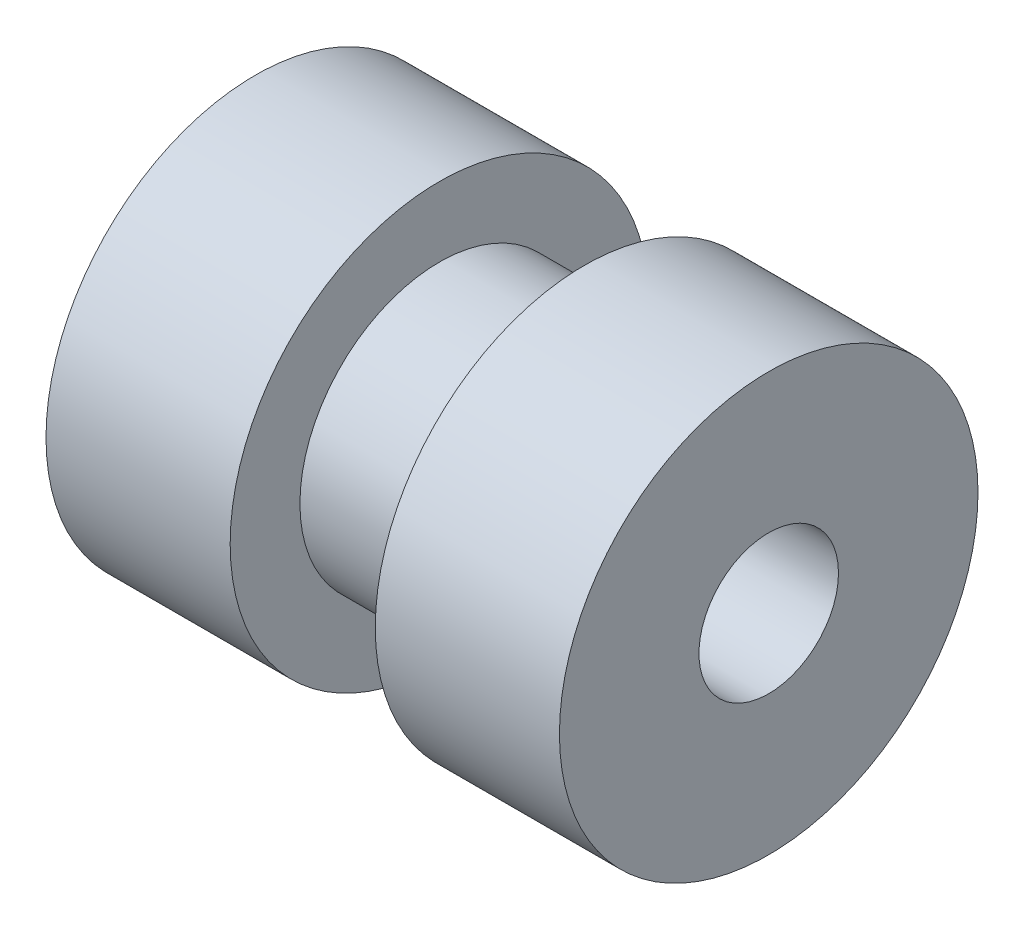
from build123d import *

# Parameters (mm, degrees)
SKETCH1_R           = 9.525
SKETCH1_R_2         = 3.175
BOSS_EXTRUDE1_DEPTH = 8.382
SKETCH2_R           = 6.35
SKETCH2_R_2         = 3.175
BOSS_EXTRUDE2_DEPTH = 6.604
SKETCH3_R           = 9.525
SKETCH3_R_2         = 3.175
BOSS_EXTRUDE3_DEPTH = 8.382


with BuildPart() as part:
    # Sketch1 → Boss-Extrude1 (new body)
    with BuildSketch(Plane(origin=(0, 0, 0), x_dir=(0, 0, -1), z_dir=(1, 0, 0))):
        Circle(SKETCH1_R)
        Circle(SKETCH1_R_2, mode=Mode.SUBTRACT)
    extrude(amount=BOSS_EXTRUDE1_DEPTH)

    # Sketch2 → Boss-Extrude2 (add)
    with BuildSketch(Plane(origin=(8.382, 0, 0), x_dir=(0, 0, -1), z_dir=(1, 0, 0))):
        with Locations(Location((0, 0, 0), (0, 0, 180))):
            Circle(SKETCH2_R)
        Circle(SKETCH2_R_2, mode=Mode.SUBTRACT)
    extrude(amount=BOSS_EXTRUDE2_DEPTH)

    # Sketch3 → Boss-Extrude3 (add)
    with BuildSketch(Plane(origin=(14.986, 0, 0), x_dir=(0, 0, -1), z_dir=(1, 0, 0))):
        Circle(SKETCH3_R)
        Circle(SKETCH3_R_2, mode=Mode.SUBTRACT)
    extrude(amount=BOSS_EXTRUDE3_DEPTH)


solid = part.part
